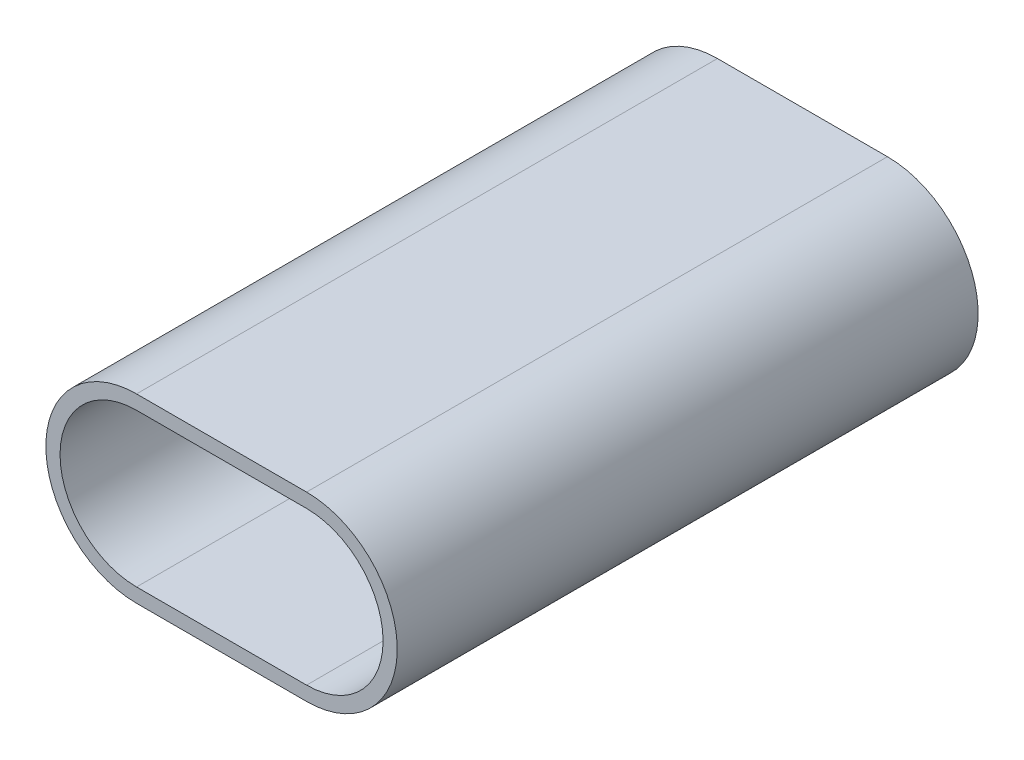
from build123d import *

# Parameters (mm, degrees)
PROFILE_DEPTH = 10.25
POCKET_DEPTH  = 19.5
HOLES_R       = 2
HOLE_DEPTH    = 1


with BuildPart() as part:
    # ProfileS → Profile (new, symmetric)
    with BuildSketch(Plane.XY):
        with BuildLine():
            Line((-3, 3.2), (3, 3.2))
            ThreePointArc((3, 3.2), (6.2, 0), (3, -3.2))
            Line((3, -3.2), (-3, -3.2))
            ThreePointArc((-3, -3.2), (-6.2, 0), (-3, 3.2))
        make_face()
    extrude(amount=PROFILE_DEPTH, both=True)

    # PocketS → Pocket (cut)
    with BuildSketch(Plane.XY.offset(10.25)):
        with BuildLine():
            Line((-3, -2.7), (3, -2.7))
            ThreePointArc((3, -2.7), (5.7, 0), (3, 2.7))
            Line((3, 2.7), (-3, 2.7))
            ThreePointArc((-3, 2.7), (-5.7, 0), (-3, -2.7))
        make_face()
    extrude(amount=-POCKET_DEPTH, mode=Mode.SUBTRACT)

    # HoleS → Hole (cut)
    with BuildSketch(Plane(origin=(0, 0, -10.25), x_dir=(-1, 0, 0), z_dir=(0, 0, -1))):
        Circle(HOLES_R)
    extrude(amount=-HOLE_DEPTH, mode=Mode.SUBTRACT)


solid = part.part
